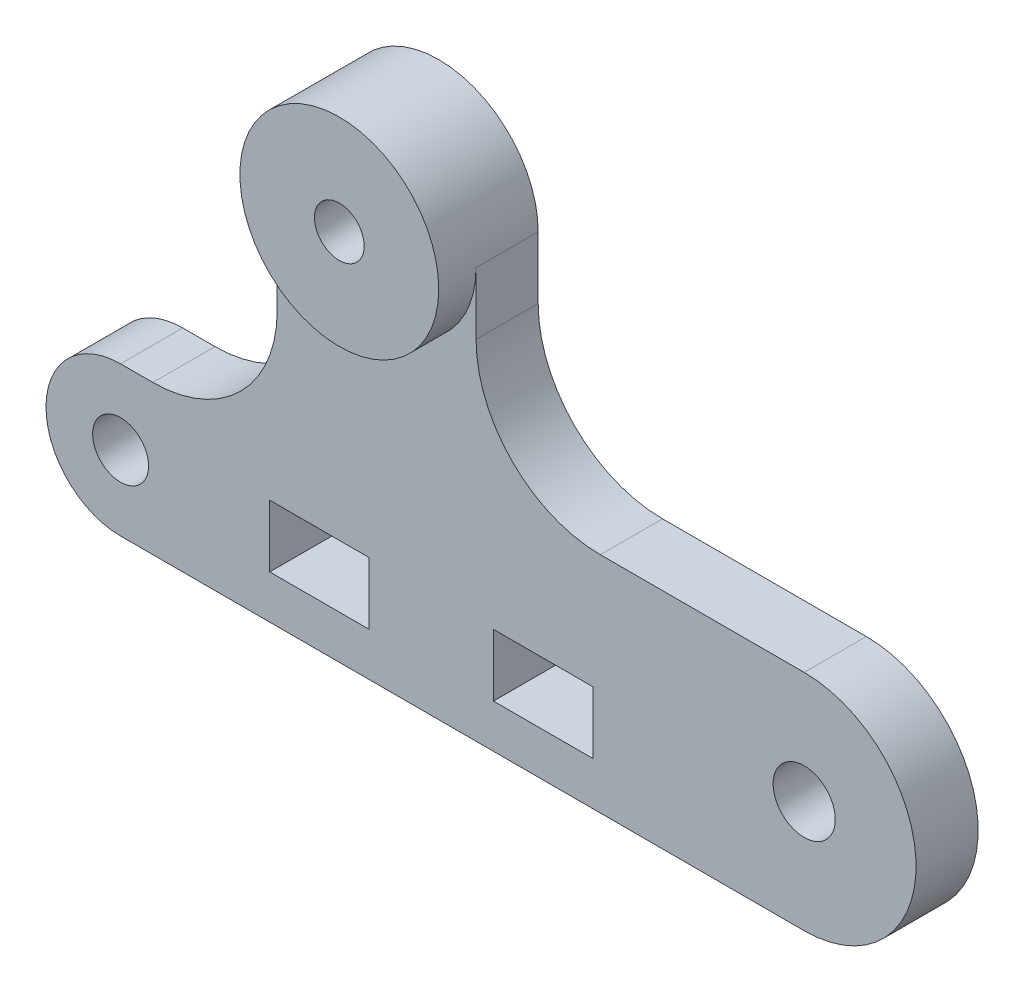
from build123d import *

# Parameters (mm, degrees)
SKETCH1_R           = 2.5
SKETCH1_R_2         = 2.25
SKETCH1_W           = 8
SKETCH1_H           = 5
BOSS_EXTRUDE1_DEPTH = 2.5
EXTRUDE_START       = 3
SKETCH_2_R          = 8
SKETCH_2_R_2        = 2
EXTRUDE_1_DEPTH     = 3


with BuildPart() as part:
    # Sketch1 → Boss-Extrude1 (new, symmetric)
    with BuildSketch(Plane.XY):
        with BuildLine():
            Line((-27.5, 0), (27.5, 0))
            ThreePointArc((27.5, 0), (36.5, 9), (27.5, 18))
            Line((27.5, 18), (11.1, 18))
            ThreePointArc((11.1, 18), (4.028932188, 20.928932188), (1.1, 28))
            Line((1.1, 28), (1.1, 33))
            ThreePointArc((1.1, 33), (-6.9, 41), (-14.9, 33))
            Line((-14.9, 33), (-14.9, 22))
            ThreePointArc((-14.9, 22), (-17.828932188, 14.928932188), (-24.9, 12))
            Line((-24.9, 12), (-27.5, 12))
            ThreePointArc((-27.5, 12), (-33.5, 6), (-27.5, 0))
        make_face()
        with Locations((27.5, 9)):
            Circle(SKETCH1_R, mode=Mode.SUBTRACT)
        with Locations((-27.5, 6)):
            Circle(SKETCH1_R_2, mode=Mode.SUBTRACT)
        with Locations((-6.9, 33)):
            Circle(SKETCH1_R_2, mode=Mode.SUBTRACT)
        with Locations((-11.5, 6)):
            Rectangle(SKETCH1_W, SKETCH1_H, mode=Mode.SUBTRACT)
        with Locations((6.5, 6)):
            Rectangle(SKETCH1_W, SKETCH1_H, mode=Mode.SUBTRACT)
    extrude(amount=BOSS_EXTRUDE1_DEPTH, both=True)

    # 草图2 → 凸台-拉伸1 (add)
    with BuildSketch(Plane.XY.offset(2.5).offset(EXTRUDE_START)):
        with Locations((-6.9, 33)):
            Circle(SKETCH_2_R)
        with Locations((-6.9, 33)):
            Circle(SKETCH_2_R_2, mode=Mode.SUBTRACT)
    extrude(amount=-EXTRUDE_1_DEPTH)


solid = part.part
